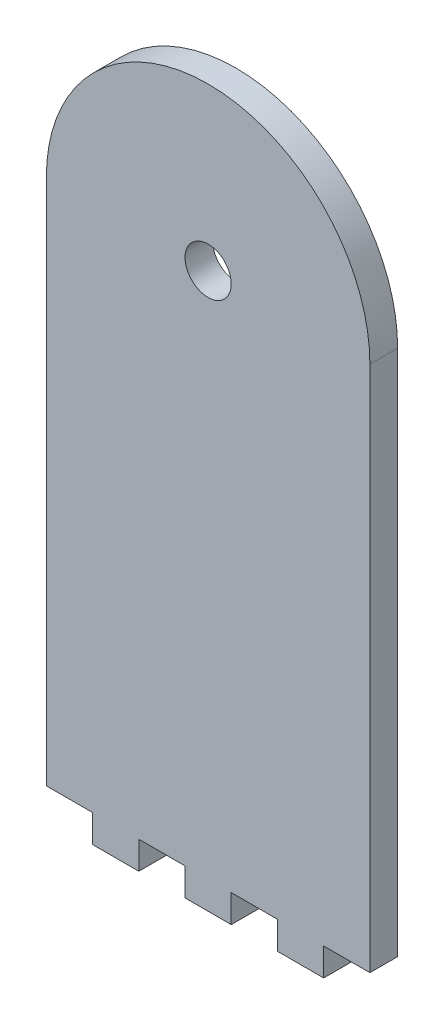
from build123d import *

# Parameters (mm, degrees)
CROQUIS1_R              = 2.5
SALIENTE_EXTRUIR1_DEPTH = 3


with BuildPart() as part:
    # Croquis1 → Saliente-Extruir1 (new body)
    with BuildSketch(Plane.XY):
        with BuildLine():
            Line((-12.5, -30), (-7.5, -30))
            Line((-7.5, -30), (-7.5, -27))
            Line((-7.5, -27), (-2.5, -27))
            Line((-2.5, -27), (-2.5, -30))
            Line((-2.5, -30), (2.5, -30))
            Line((2.5, -30), (2.5, -27))
            Line((2.5, -27), (7.5, -27))
            Line((7.5, -27), (7.5, -30))
            Line((7.5, -30), (12.5, -30))
            Line((12.5, -30), (12.5, -27))
            Line((12.5, -27), (17.5, -27))
            Line((17.5, -27), (17.5, 30))
            ThreePointArc((17.5, 30), (0, 47.5), (-17.5, 30))
            Line((-17.5, 30), (-17.5, -27))
            Line((-17.5, -27), (-12.5, -27))
            Line((-12.5, -27), (-12.5, -30))
        make_face()
        with Locations((0, 30)):
            Circle(CROQUIS1_R, mode=Mode.SUBTRACT)
    extrude(amount=SALIENTE_EXTRUIR1_DEPTH)


solid = part.part
